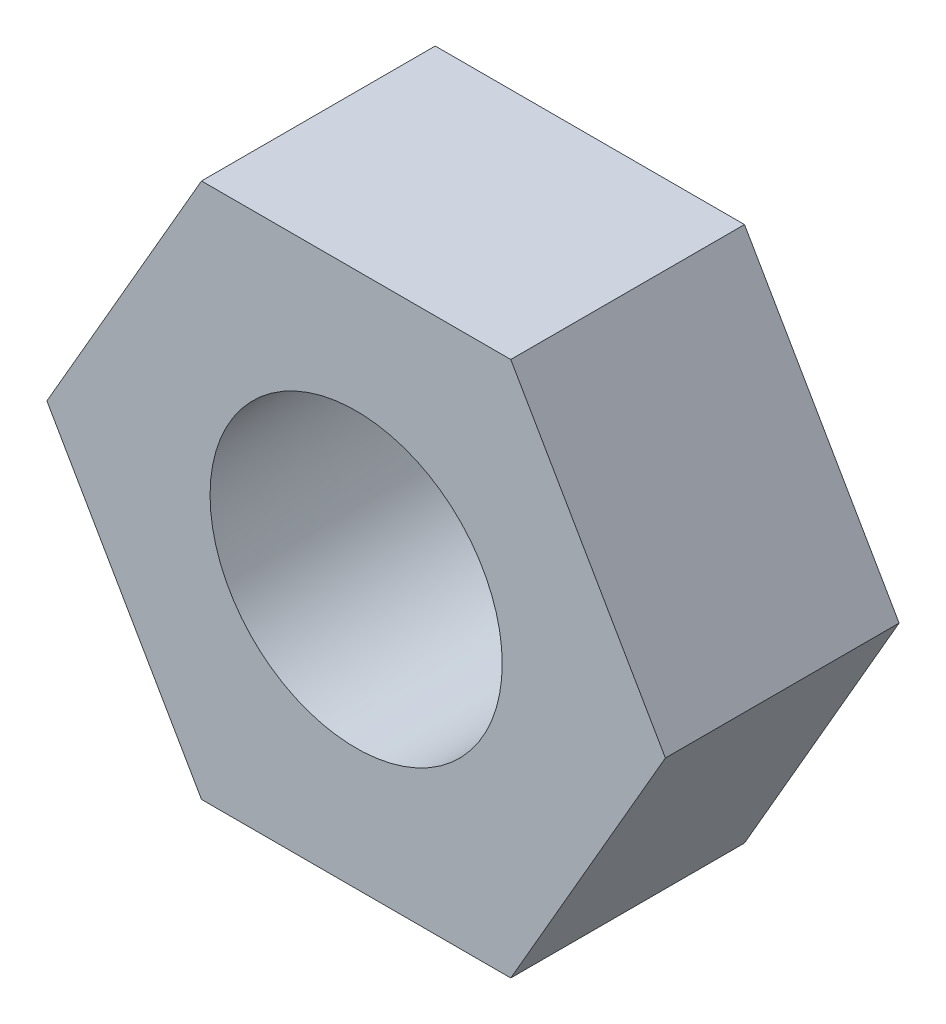
from build123d import *

# Parameters (mm, degrees)
SKETCH_1_R        = 1.5
EXTRUDE_210_DEPTH = 2.4


with BuildPart() as part:
    # 草图1 → Extrude 210 (new body)
    with BuildSketch(Plane.XY):
        Polygon((3.175426481, 0), (1.58771324, 2.75), (-1.58771324, 2.75), (-3.175426481, 0), (-1.58771324, -2.75), (1.58771324, -2.75), align=None)
        Circle(SKETCH_1_R, mode=Mode.SUBTRACT)
    extrude(amount=EXTRUDE_210_DEPTH)


solid = part.part
